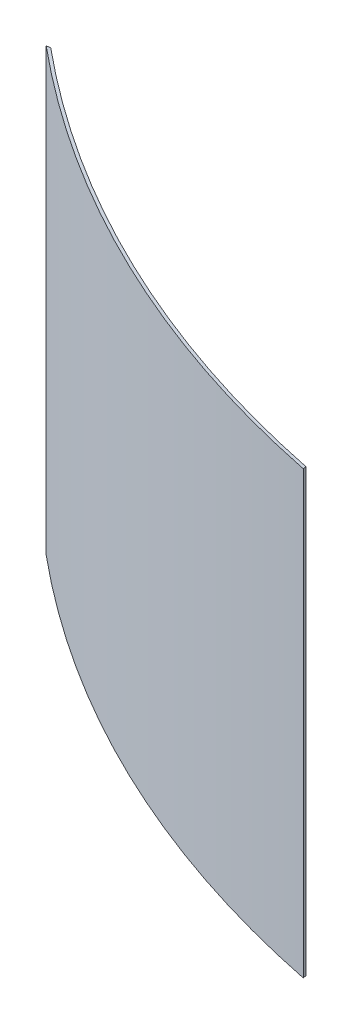
from build123d import *

# Parameters (mm, degrees)
SKETCH1_R           = 51.029755332
SKETCH1_R_2         = 50.895830663
BOSS_EXTRUDE1_DEPTH = 20
CUT_EXTRUDE1_DEPTH  = 50
CUT_EXTRUDE3_DEPTH  = 50
CUT_EXTRUDE4_DEPTH  = 50


with BuildPart() as part:
    # Sketch1 → Boss-Extrude1 (new body)
    with BuildSketch(Plane(origin=(0, 0, 0), x_dir=(1, 0, 0), z_dir=(0, 1, 0))):
        with Locations(Location((0, 0, 0), (0, 0, 270))):
            Circle(SKETCH1_R)
        with Locations(Location((0, 0, 0), (0, 0, 270))):
            Circle(SKETCH1_R_2, mode=Mode.SUBTRACT)
    extrude(amount=BOSS_EXTRUDE1_DEPTH)

    # Sketch2 → Cut-Extrude1 (cut)
    with BuildSketch(Plane(origin=(0, 0, 0), x_dir=(1, 0, 0), z_dir=(0, 1, 0))):
        with BuildLine():
            add(Edge.make_bspline(
                [(-34.904731033, -39.559214609), (-30.458455569, -39.265509231), (-8.75106143, -27.58858136), (20.545320777, -14.807136755), (86.675168203, -3.797801784), (38.172145901, 77.469799439), (-39.909980954, 55.809798543), (-65.468102513, 4.660444989), (-50.700851491, -40.602650978), (-34.904731033, -39.559214609)],
                knots=[0, 0, 0, 0, 0.04430768, 0.194241153, 0.328566983, 0.483905616, 0.753189396, 0.842589722, 1, 1, 1, 1], degree=3))
        make_face()
    extrude(amount=CUT_EXTRUDE1_DEPTH, mode=Mode.SUBTRACT)

    # Sketch3 → Cut-Extrude3 (cut)
    with BuildSketch(Plane(origin=(0, 0, 0), x_dir=(1, 0, 0), z_dir=(0, 1, 0))):
        with BuildLine():
            add(Edge.make_bspline(
                [(15.246268895, -30.627230393), (8.812696929, -41.78541341), (-4.179204183, -74.113546423), (71.751860115, -51.38349092), (57.353322601, 23.43159241), (26.480816992, -11.142386759), (15.246268895, -30.627230393)],
                knots=[0, 0, 0, 0, 0.165808592, 0.474148196, 0.71045873, 1, 1, 1, 1], degree=3))
        make_face()
    extrude(amount=CUT_EXTRUDE3_DEPTH, mode=Mode.SUBTRACT)

    # Sketch4 → Cut-Extrude4 (cut)
    with BuildSketch(Plane(origin=(0, 0, 0), x_dir=(1, 0, 0), z_dir=(0, 1, 0))):
        with BuildLine():
            add(Edge.make_bspline(
                [(-9.67297834, -44.564169781), (-11.510509193, -47.228479243), (-7.545033393, -65.726006155), (26.778755679, -53.527914946), (4.528101436, -45.351564648), (-7.606259285, -41.56755118), (-9.67297834, -44.564169781)],
                knots=[0, 0, 0, 0, 0.198613527, 0.560569713, 0.776614167, 1, 1, 1, 1], degree=3))
        make_face()
    extrude(amount=CUT_EXTRUDE4_DEPTH, mode=Mode.SUBTRACT)


solid = part.part
